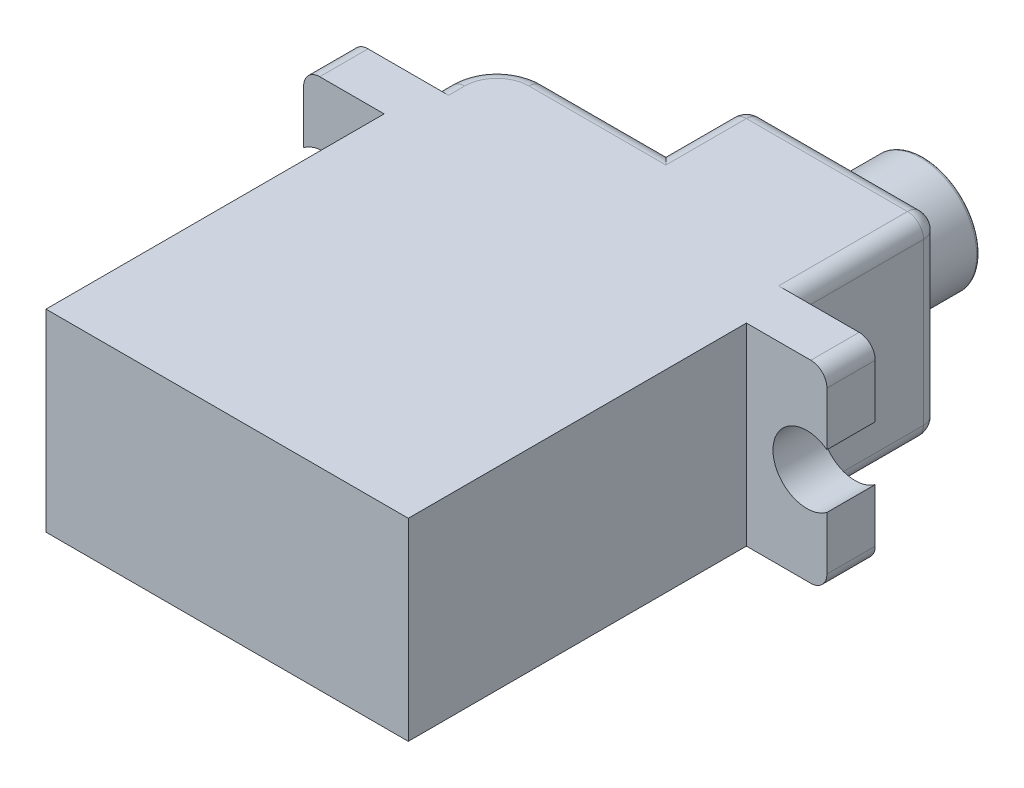
from build123d import *

# Parameters (mm, degrees)
SKETCH1_W           = 22.5
SKETCH1_H           = 12
BOSS_EXTRUDE1_DEPTH = 21
SKETCH2_W           = 32.5
SKETCH2_H           = 12
BOSS_EXTRUDE2_DEPTH = 3
SKETCH3_W           = 22.5
SKETCH3_H           = 12
BOSS_EXTRUDE6_DEPTH = 4
SKETCH5_W           = 12
SKETCH5_H           = 12
BOSS_EXTRUDE7_DEPTH = 5
SKETCH6_R           = 3.5
BOSS_EXTRUDE8_DEPTH = 5
SKETCH7_R           = 1.2
CUT_EXTRUDE1_DEPTH  = 5
FILLET3_R           = 3
FILLET4_R           = 1
FILLET5_R           = 1
FILLET6_R           = 1
FILLET7_R           = 1
FILLET8_R           = 1
FILLET9_R           = 1
FILLET10_R          = 0.2
SKETCH14_R          = 2.1
CUT_EXTRUDE4_DEPTH  = 5
SKETCH13_R          = 2.1
CUT_EXTRUDE5_DEPTH  = 5
FILLET11_R          = 1


with BuildPart() as part:
    # Sketch1 → Boss-Extrude1 (new body)
    with BuildSketch(Plane.XY):
        Rectangle(SKETCH1_W, SKETCH1_H)
    extrude(amount=BOSS_EXTRUDE1_DEPTH)

    # Sketch2 → Boss-Extrude2 (add)
    with BuildSketch(Plane.XY):
        Rectangle(SKETCH2_W, SKETCH2_H)
    extrude(amount=-BOSS_EXTRUDE2_DEPTH)

    # Sketch3 → Boss-Extrude6 (add)
    with BuildSketch(Plane(origin=(0, 0, -3), x_dir=(-1, 0, 0), z_dir=(0, 0, -1))):
        Rectangle(SKETCH3_W, SKETCH3_H)
    extrude(amount=BOSS_EXTRUDE6_DEPTH)

    # Sketch5 → Boss-Extrude7 (add)
    with BuildSketch(Plane(origin=(0, 0, -7), x_dir=(-1, 0, 0), z_dir=(0, 0, -1))):
        with Locations((-5.25, 0)):
            Rectangle(SKETCH5_W, SKETCH5_H)
    extrude(amount=BOSS_EXTRUDE7_DEPTH)

    # Sketch6 → Boss-Extrude8 (add)
    with BuildSketch(Plane(origin=(0, 0, -12), x_dir=(-1, 0, 0), z_dir=(0, 0, -1))):
        with Locations(Location((-5.25, 0, 0), (0, 0, 180))):
            Circle(SKETCH6_R)
    extrude(amount=BOSS_EXTRUDE8_DEPTH)

    # Sketch7 → Cut-Extrude1 (cut)
    with BuildSketch(Plane(origin=(0, 0, -17), x_dir=(-1, 0, 0), z_dir=(0, 0, -1))):
        with Locations((-5.25, 0)):
            Circle(SKETCH7_R)
    extrude(amount=-CUT_EXTRUDE1_DEPTH, mode=Mode.SUBTRACT)

    # Fillet3
    fillet3_edges = [part.edges().sort_by_distance(p)[0] for p in [
        (-11.25, 0, -7),
    ]]
    fillet(fillet3_edges, radius=FILLET3_R)

    # Fillet4
    fillet4_edges = [part.edges().sort_by_distance(p)[0] for p in [
        (11.25, 0, -12),
    ]]
    fillet(fillet4_edges, radius=FILLET4_R)

    # Fillet5
    fillet5_edges = [part.edges().sort_by_distance(p)[0] for p in [
        (-0.75, 0, -12),
    ]]
    fillet(fillet5_edges, radius=FILLET5_R)

    # Fillet6
    fillet6_edges = [part.edges().sort_by_distance(p)[0] for p in [
        (11.25, -6, -7),
        (10.957106781, -6, -11.707106781),
        (-0.75, -6, -9),
        (-0.457106781, -6, -11.707106781),
        (5.25, -6, -12),
    ]]
    fillet(fillet6_edges, radius=FILLET6_R)

    # Fillet7
    fillet7_edges = [part.edges().sort_by_distance(p)[0] for p in [
        (11.25, 6, -7),
        (10.957106781, 6, -11.707106781),
        (-0.75, 6, -9),
        (-0.457106781, 6, -11.707106781),
        (5.25, 6, -12),
    ]]
    fillet(fillet7_edges, radius=FILLET7_R)

    # Fillet8
    fillet8_edges = [part.edges().sort_by_distance(p)[0] for p in [
        (-11.25, 6, -3.5),
        (-10.371320344, 6, -6.121320344),
        (-4, 6, -7),
    ]]
    fillet(fillet8_edges, radius=FILLET8_R)

    # Fillet9
    fillet9_edges = [part.edges().sort_by_distance(p)[0] for p in [
        (-11.25, -6, -3.5),
        (-10.371320344, -6, -6.121320344),
        (-4, -6, -7),
    ]]
    fillet(fillet9_edges, radius=FILLET9_R)

    # Fillet10
    fillet10_edges = [part.edges().sort_by_distance(p)[0] for p in [
        (1.75, 0, -17),
    ]]
    fillet(fillet10_edges, radius=FILLET10_R)

    # Sketch14 → Cut-Extrude4 (cut)
    with BuildSketch(Plane(origin=(0, 0, -3), x_dir=(-1, 0, 0), z_dir=(0, 0, -1))):
        with Locations((15, 0)):
            Circle(SKETCH14_R)
    extrude(amount=-CUT_EXTRUDE4_DEPTH, mode=Mode.SUBTRACT)

    # Sketch13 → Cut-Extrude5 (cut)
    with BuildSketch(Plane(origin=(0, 0, -3), x_dir=(-1, 0, 0), z_dir=(0, 0, -1))):
        with Locations((-15, 0)):
            Circle(SKETCH13_R)
    extrude(amount=-CUT_EXTRUDE5_DEPTH, mode=Mode.SUBTRACT)

    # Fillet11
    fillet11_edges = [part.edges().sort_by_distance(p)[0] for p in [
        (-16.25, -6, -1.5),
        (-16.25, 6, -1.5),
        (16.25, -6, -1.5),
        (16.25, 6, -1.5),
    ]]
    fillet(fillet11_edges, radius=FILLET11_R)


solid = part.part
